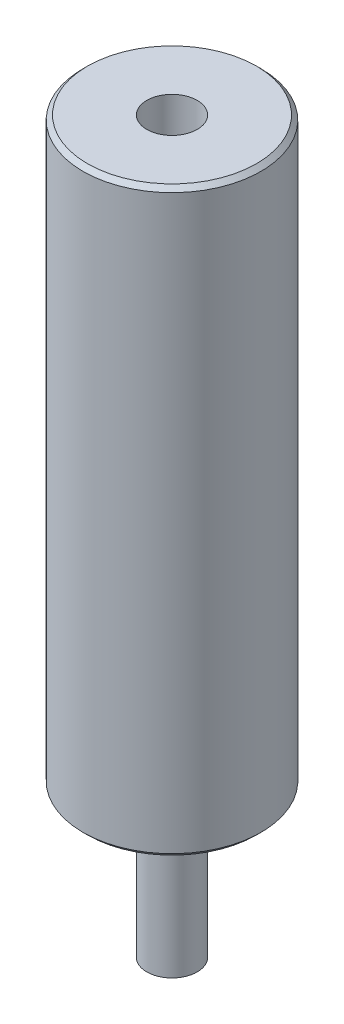
from build123d import *


with BuildPart() as part:
    # Esboço1 → Revolução1 (revolve)
    with BuildSketch(Plane(origin=(0, 0, 0), x_dir=(-1, 0, 0), z_dir=(0, 0, -1)), mode=Mode.PRIVATE) as revolu_o1_sk:
        with BuildLine():
            Line((-1.7, 0), (0, 0))
            Line((0, 0), (0, 39.2))
            Line((0, 39.2), (-1.7, 39.2))
            Line((-1.7, 39.2), (-1.7, 49.2))
            Line((-1.7, 49.2), (-5.7, 49.2))
            Line((-5.7, 49.2), (-6, 48.9))
            Line((-6, 48.9), (-6, 10.3))
            Line((-6, 10.3), (-5.7, 10))
            Line((-5.7, 10), (-2.2, 10))
            ThreePointArc((-2.2, 10), (-1.846446609, 9.853553391), (-1.7, 9.5))
            Line((-1.7, 9.5), (-1.7, 0))
        make_face()
    revolve(revolu_o1_sk.sketch.rotate(Axis((0, 0, 0), (0, 1, 0)), 270), axis=Axis((0, 0, 0), (0, 1, 0)))


solid = part.part
